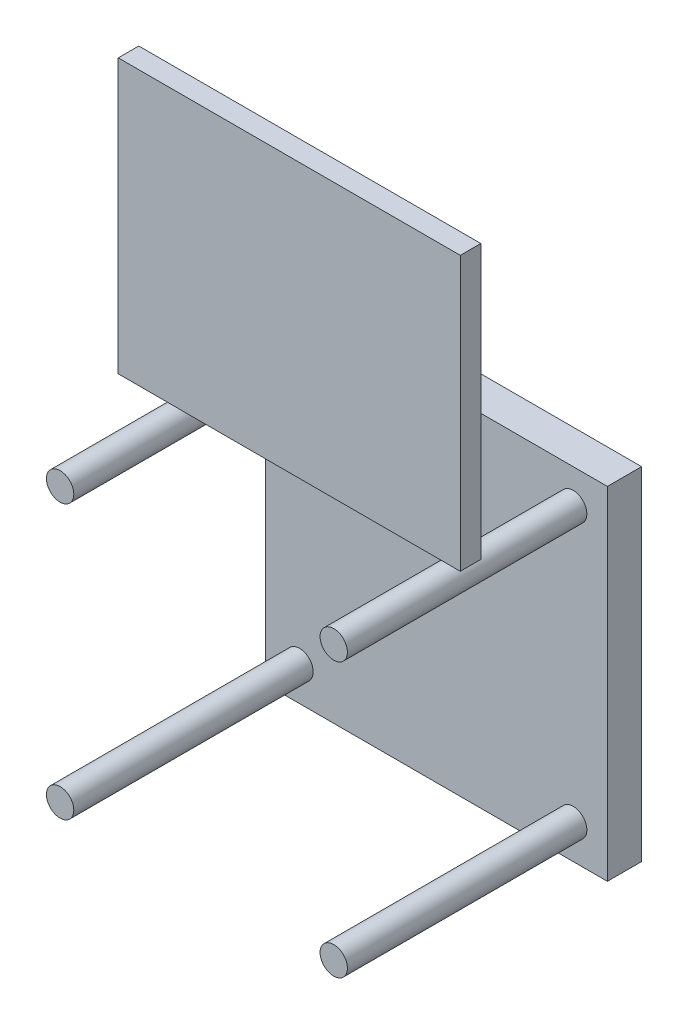
from build123d import *

# Parameters (mm, degrees)
SKETCH_1_W      = 500
SKETCH_1_H      = 500
EXTRUDE_1_DEPTH = 50
SKETCH_2_R      = 20
EXTRUDE_2_DEPTH = 400
SKETCH_3_R      = 20
EXTRUDE_3_DEPTH = 400
SKETCH_4_R      = 20
EXTRUDE_4_DEPTH = 400
SKETCH_5_R      = 20
EXTRUDE_5_DEPTH = 400
SKETCH_6_W      = 500
SKETCH_6_H      = 30
EXTRUDE_6_DEPTH = 400


with BuildPart() as part:
    # 草图1 → 凸台-拉伸1 (new body)
    with BuildSketch(Plane.XY):
        Rectangle(SKETCH_1_W, SKETCH_1_H)
    extrude(amount=EXTRUDE_1_DEPTH)

    # 草图2 → 凸台-拉伸2 (add)
    with BuildSketch(Plane.XY):
        with Locations(Location((-200, -200, 0), (0, 0, 180))):
            Circle(SKETCH_2_R)
    extrude(amount=EXTRUDE_2_DEPTH)

    # 草图3 → 凸台-拉伸3 (add)
    with BuildSketch(Plane.XY):
        with Locations(Location((200, -200, 0), (0, 0, 180))):
            Circle(SKETCH_3_R)
    extrude(amount=EXTRUDE_3_DEPTH)

    # 草图4 → 凸台-拉伸4 (add)
    with BuildSketch(Plane.XY):
        with Locations(Location((-200, 200, 0), (0, 0, 180))):
            Circle(SKETCH_4_R)
    extrude(amount=EXTRUDE_4_DEPTH)

    # 草图5 → 凸台-拉伸5 (add)
    with BuildSketch(Plane.XY):
        with Locations(Location((200, 200, 0), (0, 0, 180))):
            Circle(SKETCH_5_R)
    extrude(amount=EXTRUDE_5_DEPTH)


with BuildPart() as body_2:
    # 草图6 → 凸台-拉伸6 (new body)
    with BuildSketch(Plane(origin=(0, 250, 0), x_dir=(1, 0, 0), z_dir=(0, 1, 0))):
        with Locations((0, -250)):
            Rectangle(SKETCH_6_W, SKETCH_6_H)
    extrude(amount=EXTRUDE_6_DEPTH)


solid = Compound([part.part, body_2.part])
